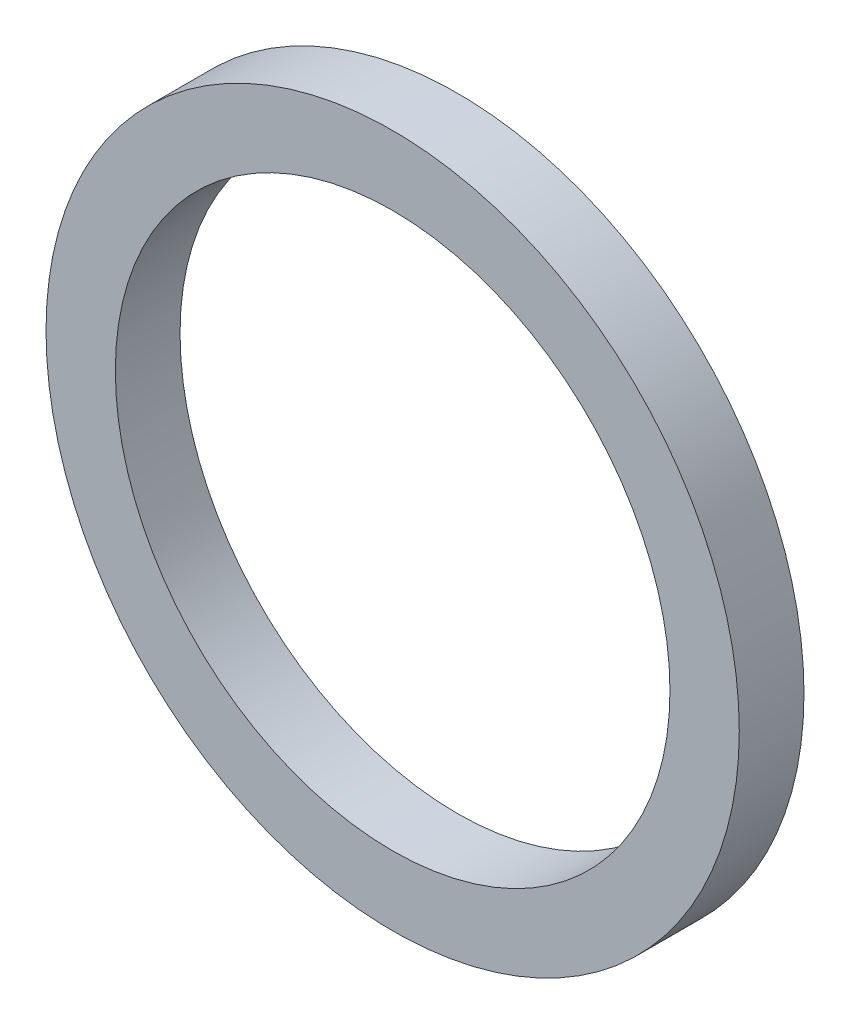
from build123d import *

# Parameters (mm, degrees)
SKETCH_1_R      = 37.5
SKETCH_1_R_2    = 30
EXTRUDE_1_DEPTH = 7


with BuildPart() as part:
    # 草图1 → 凸台-拉伸1 (new body)
    with BuildSketch(Plane.XY):
        Circle(SKETCH_1_R)
        Circle(SKETCH_1_R_2, mode=Mode.SUBTRACT)
    extrude(amount=EXTRUDE_1_DEPTH)


solid = part.part
